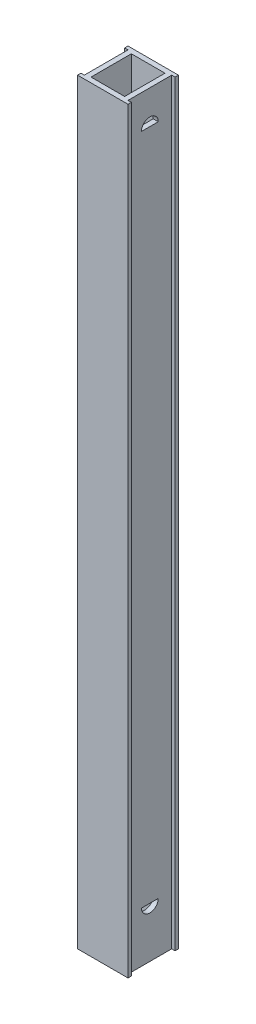
from build123d import *

# Parameters (mm, degrees)
SKETCH_1_W          = 30
SKETCH_1_H          = 450
EXTRUDE_1_DEPTH     = 30
SKETCH_2_W          = 2
SKETCH_2_H          = 26
CUT_EXTRUDE_1_DEPTH = 452.248268695
SHELL_1_T           = -3
CUT_EXTRUDE_2_DEPTH = 229.7116088


with BuildPart() as part:
    # 草图1 → 凸台-拉伸1 (new body)
    with BuildSketch(Plane.XY):
        Rectangle(SKETCH_1_W, SKETCH_1_H)
    extrude(amount=EXTRUDE_1_DEPTH)

    # 草图2 → 切除-拉伸1 (cut, through all)
    with BuildSketch(Plane(origin=(0, 225, 0), x_dir=(1, 0, 0), z_dir=(0, 1, 0))):
        with Locations((-14, -15)):
            Rectangle(SKETCH_2_W, SKETCH_2_H)
        with Locations((14, -15)):
            Rectangle(SKETCH_2_W, SKETCH_2_H)
    extrude(amount=-CUT_EXTRUDE_1_DEPTH, mode=Mode.SUBTRACT)

    # 抽壳1
    shell_1_openings = [part.faces().sort_by_distance(p)[0] for p in [
        (0, 225, 15),
        (0, -225, 15),
    ]]
    offset(amount=SHELL_1_T, openings=shell_1_openings)

    # 草图3 → 切除-拉伸2 (cut, through all)
    with BuildSketch(Plane(origin=(13, 0, 0), x_dir=(0, 0, -1), z_dir=(1, 0, 0))):
        with BuildLine():
            Line((-20, 205), (-10, 205))
            ThreePointArc((-10, 205), (-15, 210), (-20, 205))
        make_face()
        with BuildLine():
            Line((-20, -195), (-10, -195))
            ThreePointArc((-10, -195), (-15, -200), (-20, -195))
        make_face()
    extrude(amount=-CUT_EXTRUDE_2_DEPTH, mode=Mode.SUBTRACT)


solid = part.part
